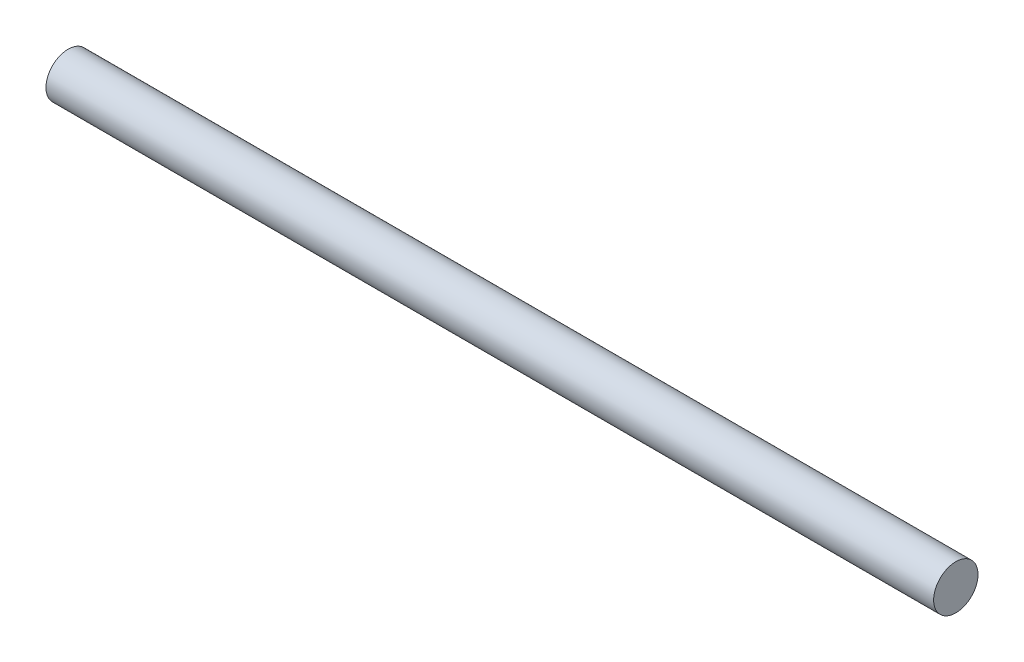
from build123d import *

# Parameters (mm, degrees)
SKETCH_1_R      = 1
EXTRUDE_1_DEPTH = 40


with BuildPart() as part:
    # 草图1 → 凸台-拉伸1 (new body)
    with BuildSketch(Plane(origin=(0, 0, 0), x_dir=(0, 0, -1), z_dir=(1, 0, 0))):
        Circle(SKETCH_1_R)
    extrude(amount=EXTRUDE_1_DEPTH)


solid = part.part
